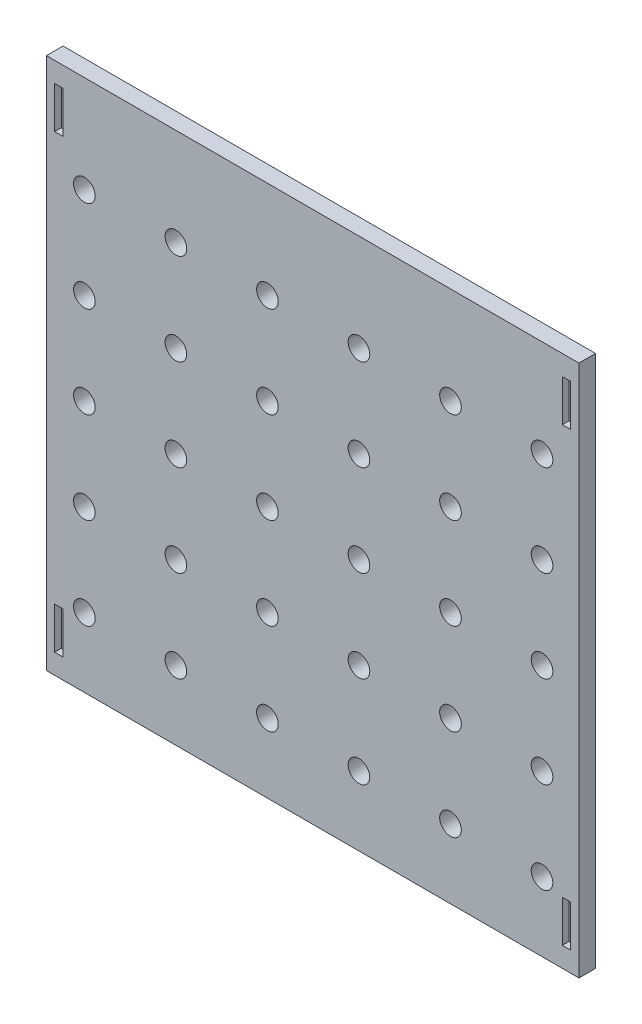
from build123d import *

# Parameters (mm, degrees)
CROQUIS1_W              = 640
CROQUIS1_H              = 640
SALIENTE_EXTRUIR1_DEPTH = 20
CROQUIS2_W              = 10.1
CROQUIS2_H              = 50.1
CORTAR_EXTRUIR1_DEPTH   = 8
CROQUIS3_R              = 13
CORTAR_EXTRUIR2_DEPTH   = 48


with BuildPart() as part:
    # Croquis1 → Saliente-Extruir1 (new body)
    with BuildSketch(Plane.XY):
        Rectangle(CROQUIS1_W, CROQUIS1_H)
    extrude(amount=SALIENTE_EXTRUIR1_DEPTH)

    # Croquis2 → Cortar-Extruir1 (cut)
    with BuildSketch(Plane.XY.offset(20)):
        with Locations((-305.05, 270.931721093)):
            Rectangle(CROQUIS2_W, CROQUIS2_H)
        with Locations((305.05, 270.931721093)):
            Rectangle(CROQUIS2_W, CROQUIS2_H)
    cortar_extruir1 = extrude(amount=-CORTAR_EXTRUIR1_DEPTH, mode=Mode.SUBTRACT)

    # Simetría1: Cortar-Extruir1 across plane
    add(cortar_extruir1.mirror(Plane.ZX), mode=Mode.SUBTRACT)

    # Croquis3 → Cortar-Extruir2 (cut)
    with BuildSketch(Plane.XY.offset(20)):
        with Locations((-274.388478244, 203.250724625)):
            Circle(CROQUIS3_R)
        with Locations((-164.388478244, 203.250724625)):
            Circle(CROQUIS3_R)
        with Locations((-54.388478244, 203.250724625)):
            Circle(CROQUIS3_R)
        with Locations((55.611521756, 203.250724625)):
            Circle(CROQUIS3_R)
        with Locations((165.611521756, 203.250724625)):
            Circle(CROQUIS3_R)
        with Locations((275.611521756, 203.250724625)):
            Circle(CROQUIS3_R)
        with Locations((-164.388478244, 93.250724625)):
            Circle(CROQUIS3_R)
        with Locations((-54.388478244, 93.250724625)):
            Circle(CROQUIS3_R)
        with Locations((55.611521756, 93.250724625)):
            Circle(CROQUIS3_R)
        with Locations((165.611521756, 93.250724625)):
            Circle(CROQUIS3_R)
        with Locations((275.611521756, 93.250724625)):
            Circle(CROQUIS3_R)
        with Locations((-164.388478244, -16.749275375)):
            Circle(CROQUIS3_R)
        with Locations((-54.388478244, -16.749275375)):
            Circle(CROQUIS3_R)
        with Locations((55.611521756, -16.749275375)):
            Circle(CROQUIS3_R)
        with Locations((165.611521756, -16.749275375)):
            Circle(CROQUIS3_R)
        with Locations((275.611521756, -16.749275375)):
            Circle(CROQUIS3_R)
        with Locations((-164.388478244, -126.749275375)):
            Circle(CROQUIS3_R)
        with Locations((-54.388478244, -126.749275375)):
            Circle(CROQUIS3_R)
        with Locations((55.611521756, -126.749275375)):
            Circle(CROQUIS3_R)
        with Locations((165.611521756, -126.749275375)):
            Circle(CROQUIS3_R)
        with Locations((275.611521756, -126.749275375)):
            Circle(CROQUIS3_R)
        with Locations((-164.388478244, -236.749275375)):
            Circle(CROQUIS3_R)
        with Locations((-54.388478244, -236.749275375)):
            Circle(CROQUIS3_R)
        with Locations((55.611521756, -236.749275375)):
            Circle(CROQUIS3_R)
        with Locations((165.611521756, -236.749275375)):
            Circle(CROQUIS3_R)
        with Locations((275.611521756, -236.749275375)):
            Circle(CROQUIS3_R)
        with Locations((-274.388478244, 93.250724625)):
            Circle(CROQUIS3_R)
        with Locations((-274.388478244, -16.749275375)):
            Circle(CROQUIS3_R)
        with Locations((-274.388478244, -126.749275375)):
            Circle(CROQUIS3_R)
        with Locations((-274.388478244, -236.749275375)):
            Circle(CROQUIS3_R)
    extrude(amount=-CORTAR_EXTRUIR2_DEPTH, mode=Mode.SUBTRACT)


solid = part.part
